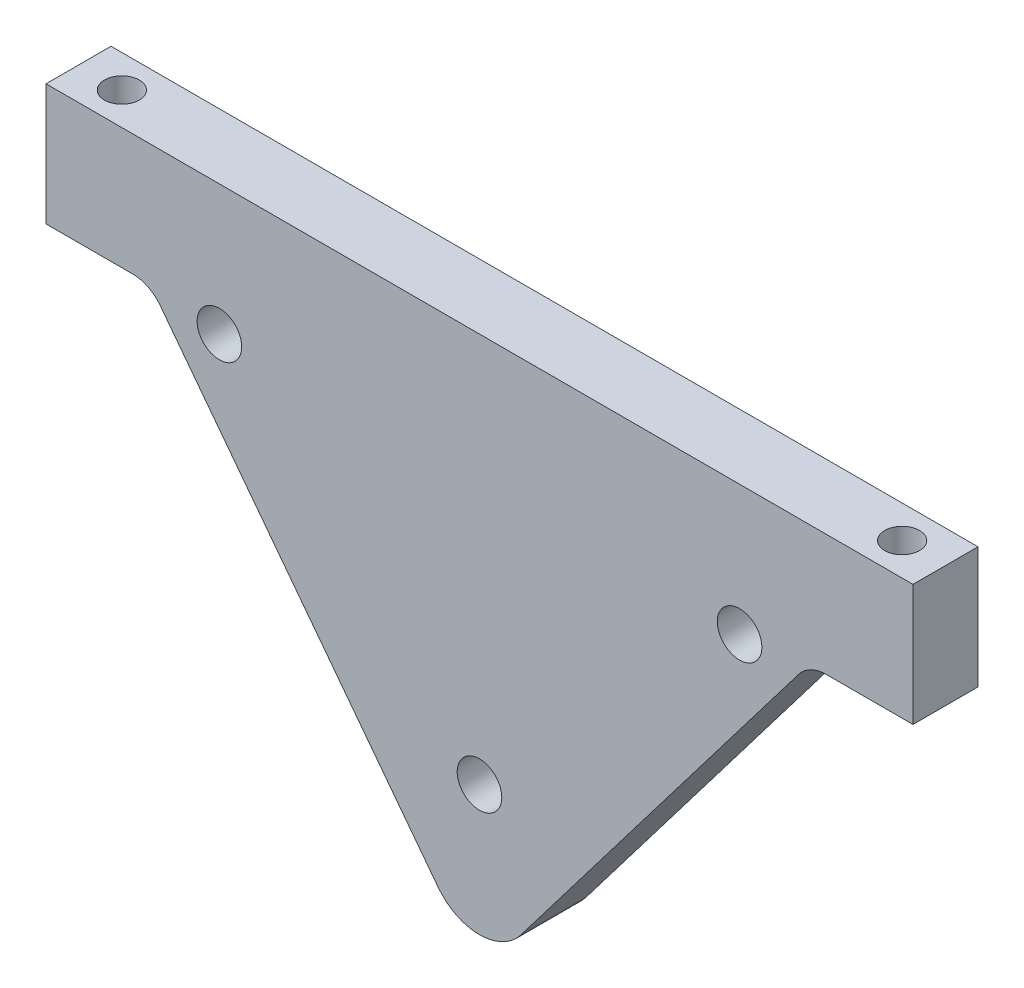
from build123d import *

# Parameters (mm, degrees)
BOSS_EXTRUDE1_DEPTH      = 9.525
F_0_257_DIAMETER_HOLE1_D = 6.5278
F_1_4_20_TAPPED_HOLE1_D  = 5.1054


with BuildPart() as part:
    # Sketch2 → Boss-Extrude1 (new body)
    with BuildSketch(Plane.XY):
        with BuildLine():
            Line((46.759190155, 52.701629037), (6.061214767, -0.715064976))
            ThreePointArc((6.061214767, -0.715064976), (0, -3.717048568), (-6.061214767, -0.715064976))
            Line((-6.061214767, -0.715064976), (-46.759190155, 52.701629037))
            ThreePointArc((-46.759190155, 52.701629037), (-48.545369458, 54.175208138), (-50.8, 54.702951432))
            Line((-50.8, 54.702951432), (-63.5, 54.702951432))
            Line((-63.5, 54.702951432), (-63.5, 72.482951432))
            Line((-63.5, 72.482951432), (63.5, 72.482951432))
            Line((63.5, 72.482951432), (63.5, 54.702951432))
            Line((63.5, 54.702951432), (50.8, 54.702951432))
            ThreePointArc((50.8, 54.702951432), (48.545369458, 54.175208138), (46.759190155, 52.701629037))
        make_face()
    extrude(amount=BOSS_EXTRUDE1_DEPTH)

    # F (0.257) Diameter Hole1 (through all)
    with Locations(Plane.XY.offset(9.525)):
        with Locations((0, 15.332951432), (-38.1, 53.432951432), (38.1, 53.432951432)):
            Hole(F_0_257_DIAMETER_HOLE1_D / 2)

    # 1/4-20 Tapped Hole1 (through all)
    with Locations(Plane(origin=(0, 72.482951432, 0), x_dir=(1, 0, 0), z_dir=(0, 1, 0))):
        with Locations((-57.15, -4.7625), (57.15, -4.7625)):
            Hole(F_1_4_20_TAPPED_HOLE1_D / 2)


solid = part.part
